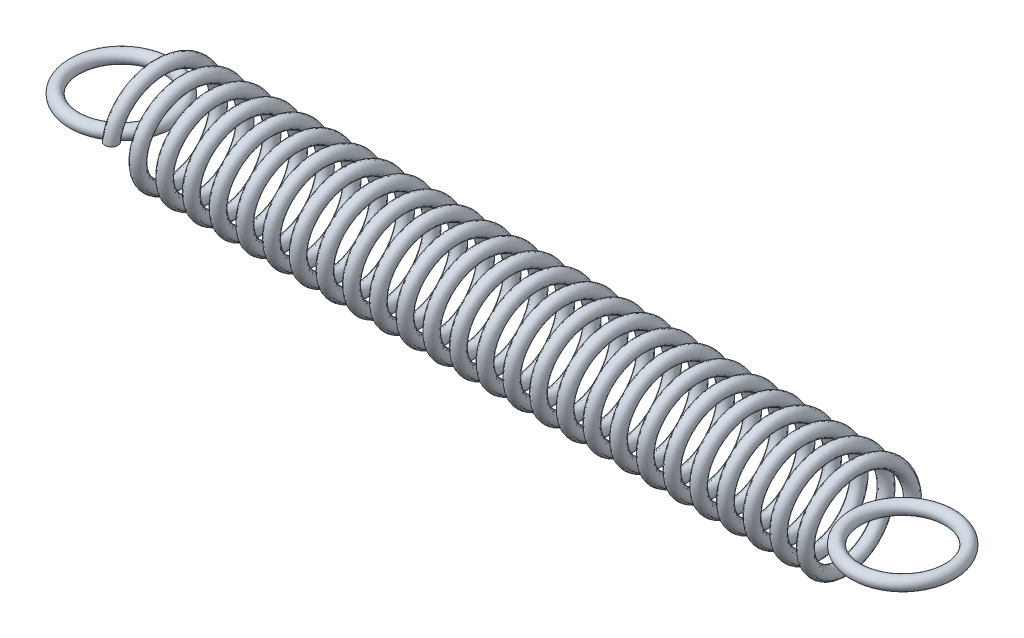
from build123d import *

# Parameters (mm, degrees)
SWEEP1_PITCH  = 2.54
SWEEP1_HEIGHT = 67.31
SWEEP1_RADIUS = 4.4577
SKETCH3_R     = 0.6096
SKETCH5_R     = 0.6096
SKETCH7_R     = 0.6096


with BuildPart() as part:
    # Sweep1: sweep along a helix
    with BuildLine() as sweep1_path:
        Helix(SWEEP1_PITCH, SWEEP1_HEIGHT, SWEEP1_RADIUS, center=(0, 0, 0), direction=(1, 0, 0), lefthand=True)
    # Sketch3 → Sweep1 (sweep)
    with BuildSketch(Plane.XY):
        with Locations((0, 4.4577)):
            Circle(SKETCH3_R)
    sweep(path=sweep1_path.line, is_frenet=True)


with BuildPart() as body_2:
    # Sweep2: sweep along a path in Sketch4
    with BuildLine(Plane(origin=(0, 0, 0), x_dir=(1, 0, 0), z_dir=(0, -0.9999999999999278, 3.800891182405508e-07))) as sweep2_path:
        CenterArc((-4.150124925, 0), 5.067300006, 0, 360)
    # Sketch5 → Sweep2 (sweep)
    with BuildSketch(Plane(origin=(-4.150124925, 0, 0), x_dir=(0, 0, -1), z_dir=(1, 0, 0))):
        with Locations((4.4577, 0)):
            Circle(SKETCH5_R)
    sweep(path=sweep2_path.line)


with BuildPart() as body_3:
    # Sweep3: sweep along a path in Sketch6
    with BuildLine(Plane(origin=(0, 0, 0), x_dir=(1, 0, 0), z_dir=(0, -0.9999999999999278, 3.800891181180863e-07))) as sweep3_path:
        CenterArc((70.190125233, 0), 5.0673, 0, 360)
    # Sketch7 → Sweep3 (sweep)
    with BuildSketch(Plane(origin=(70.190125233, 0, 0), x_dir=(0, 0, -1), z_dir=(1, 0, 0))):
        with Locations((-4.4577, 0)):
            Circle(SKETCH7_R)
    sweep(path=sweep3_path.line)


solid = Compound([part.part, body_2.part, body_3.part])
